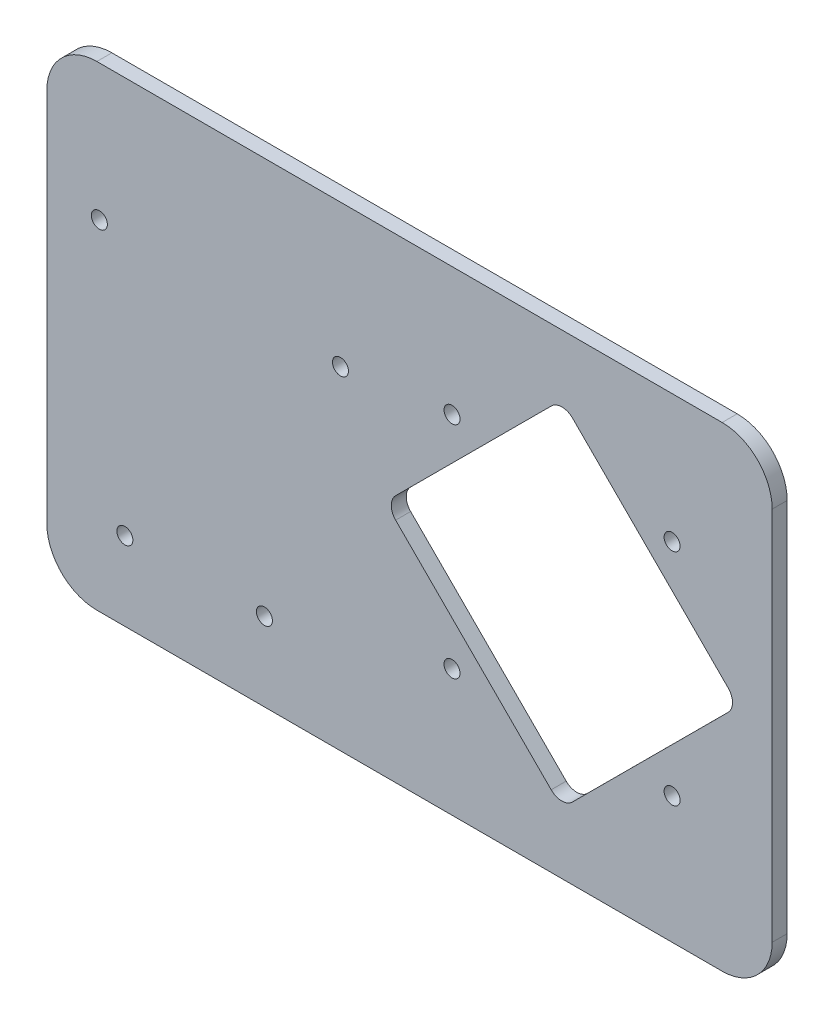
from build123d import *

# Parameters (mm, degrees)
SKETCH_1_R          = 1.600036364
EXTRUDE_1_DEPTH     = 3
CUT_EXTRUDE_1_DEPTH = 1


with BuildPart() as part:
    # 草图1 → 凸台-拉伸1 (new body)
    with BuildSketch(Plane(origin=(0, 0, 0), x_dir=(-1, 0, 0), z_dir=(0, 0, -1))):
        with BuildLine():
            Line((-269.074115321, 2.313772586), (-144.071274347, 2.313772586))
            ThreePointArc((-144.071274347, 2.313772586), (-137.000045826, 5.242771342), (-134.071047069, 12.313999864))
            Line((-134.071047069, 12.313999864), (-134.071047069, 87.314984431))
            ThreePointArc((-134.071047069, 87.314984431), (-137.000045826, 94.386212953), (-144.071274347, 97.315211709))
            Line((-144.071274347, 97.315211709), (-269.074115321, 97.315211709))
            ThreePointArc((-269.074115321, 97.315211709), (-276.145343842, 94.386212953), (-279.074342599, 87.314984431))
            Line((-279.074342599, 87.314984431), (-279.074342599, 12.313999864))
            ThreePointArc((-279.074342599, 12.313999864), (-276.145343842, 5.242771342), (-269.074115321, 2.313772586))
        make_face()
        with Locations(Location((-144.571285711, 70.12985919, 0), (0, 0, 180))):
            Circle(SKETCH_1_R, mode=Mode.SUBTRACT)
        with Locations(Location((-192.771381168, 68.83052966, 0), (0, 0, 180))):
            Circle(SKETCH_1_R, mode=Mode.SUBTRACT)
        with Locations(Location((-149.671401623, 18.029175084, 0), (0, 0, 180))):
            Circle(SKETCH_1_R, mode=Mode.SUBTRACT)
        with Locations(Location((-215.07288802, 71.689494637, 0), (0, 0, 180))):
            Circle(SKETCH_1_R, mode=Mode.SUBTRACT)
        with Locations(Location((-259.07288802, 71.689494637, 0), (0, 0, 180))):
            Circle(SKETCH_1_R, mode=Mode.SUBTRACT)
        with Locations(Location((-259.07288802, 27.689494637, 0), (0, 0, 180))):
            Circle(SKETCH_1_R, mode=Mode.SUBTRACT)
        with Locations(Location((-215.07288802, 27.689494637, 0), (0, 0, 180))):
            Circle(SKETCH_1_R, mode=Mode.SUBTRACT)
        with Locations(Location((-177.572035728, 18.029175084, 0), (0, 0, 180))):
            Circle(SKETCH_1_R, mode=Mode.SUBTRACT)
        with BuildLine():
            Line((-270.272386965, 51.970422951), (-239.177738445, 83.102172244))
            ThreePointArc((-239.177738445, 83.102172244), (-237.056894166, 83.982136522), (-234.935002086, 83.104701859))
            Line((-234.935002086, 83.104701859), (-203.802990784, 52.009791643))
            ThreePointArc((-203.802990784, 52.009791643), (-202.923026506, 49.888947364), (-203.80046117, 47.767055284))
            Line((-203.80046117, 47.767055284), (-234.89510969, 16.635305991))
            ThreePointArc((-234.89510969, 16.635305991), (-237.015953969, 15.755341713), (-239.137846048, 16.632776376))
            Line((-239.137846048, 16.632776376), (-270.26985735, 47.727686592))
            ThreePointArc((-270.26985735, 47.727686592), (-271.149821628, 49.848530871), (-270.272386965, 51.970422951))
        make_face(mode=Mode.SUBTRACT)
    extrude(amount=-EXTRUDE_1_DEPTH)

    # 草图2 → 切除-拉伸1 (cut)
    # profile 1 of 6: a face of its own
    with BuildSketch(Plane(origin=(0, 0, 0), x_dir=(-1, 0, 0), z_dir=(0, 0, -1))):
        with BuildLine():
            Line((-225.093095347, 15.50330718), (-220.537800383, 15.50330718))
            Line((-220.537800383, 15.50330718), (-220.537800383, 15.367732925))
            Line((-220.537800383, 15.367732925), (-224.222166334, 10.505497847))
            Line((-224.222166334, 10.505497847), (-222.573583394, 10.505497847))
            add(Edge.make_bspline(
                [(-222.573583394, 10.505497847), (-222.502991146, 10.507374956), (-222.3651986, 10.511038979), (-222.164076811, 10.539576628), (-221.974353471, 10.587423831), (-221.795082895, 10.653637513), (-221.626911343, 10.739532065), (-221.471208506, 10.846181354), (-221.325318206, 10.969610925), (-221.240235911, 11.065493876), (-221.197233558, 11.113955103)],
                knots=[0, 0, 0, 0, 1.087850049, 2.123429013, 3.123615998, 4.098726134, 5.063268957, 6.02621668, 7.00240907, 8, 8, 8, 8], degree=3))
            add(Edge.make_bspline(
                [(-221.197233558, 11.113955103), (-221.160213875, 11.160573702), (-221.087509946, 11.252129195), (-220.988974031, 11.393547925), (-220.900538848, 11.534279816), (-220.835970031, 11.654557391), (-220.787585924, 11.755360824), (-220.75138098, 11.83957139), (-220.713161008, 11.932034564), (-220.674217845, 12.032968505), (-220.6343878, 12.142272753), (-220.59275433, 12.259999862), (-220.550915741, 12.38634293), (-220.522905813, 12.473651547), (-220.508516343, 12.518504384)],
                knots=[0, 0, 0, 0, 1.359568562, 2.670092451, 3.935066789, 5.154440148, 5.78610453, 6.488817126, 7.247983232, 8.071572823, 8.959904472, 9.905437431, 10.923965642, 12, 12, 12, 12], degree=3))
            Line((-220.508516343, 12.518504384), (-220.372942089, 12.518504384))
            Line((-220.372942089, 12.518504384), (-220.372942089, 10.36666981))
            Line((-220.372942089, 10.36666981), (-225.44016544, 10.36666981))
            Line((-225.44016544, 10.36666981), (-225.44016544, 10.509836223))
            Line((-225.44016544, 10.509836223), (-221.760137865, 15.364479143))
            Line((-221.760137865, 15.364479143), (-222.85449325, 15.364479143))
            add(Edge.make_bspline(
                [(-222.85449325, 15.364479143), (-222.932321092, 15.363107428), (-223.084181934, 15.360430883), (-223.304433697, 15.331142607), (-223.510713089, 15.286612655), (-223.70240001, 15.222121744), (-223.879862369, 15.139424347), (-224.044182414, 15.039533689), (-224.1931042, 14.919515995), (-224.279628039, 14.8265302), (-224.323033579, 14.779882956)],
                knots=[0, 0, 0, 0, 1.143717852, 2.231668664, 3.260889947, 4.242627479, 5.198684023, 6.134108069, 7.063956852, 8, 8, 8, 8], degree=3))
            add(Edge.make_bspline(
                [(-224.323033579, 14.779882956), (-224.35709593, 14.74193829), (-224.423678301, 14.667767078), (-224.514136336, 14.552378141), (-224.593002998, 14.436514816), (-224.664774822, 14.316653148), (-224.731663607, 14.181662021), (-224.801488526, 14.023253525), (-224.877511199, 13.836281404), (-224.927552826, 13.70122689), (-224.95426731, 13.62912868)],
                knots=[0, 0, 0, 0, 0.924735901, 1.807600145, 2.6570251, 3.465651904, 4.339606012, 5.387636385, 6.60540209, 8, 8, 8, 8], degree=3))
            Line((-224.95426731, 13.62912868), (-225.093095347, 13.62912868))
            Line((-225.093095347, 13.62912868), (-225.093095347, 15.50330718))
        make_face()
    # profile 2 of 6: a face of its own
    with BuildSketch(Plane(origin=(0, 0, 0), x_dir=(-1, 0, 0), z_dir=(0, 0, -1))):
        with BuildLine():
            Line((-217.449744234, 15.50330718), (-213.954097646, 15.50330718))
            Line((-213.954097646, 15.50330718), (-213.954097646, 15.364479143))
            Line((-213.954097646, 15.364479143), (-214.104856217, 15.364479143))
            add(Edge.make_bspline(
                [(-214.104856217, 15.364479143), (-214.142870964, 15.364181767), (-214.21621477, 15.363608026), (-214.322472747, 15.349928298), (-214.422101794, 15.334624697), (-214.513801362, 15.307205802), (-214.599144004, 15.276152154), (-214.675543907, 15.233244773), (-214.746246321, 15.18657651), (-214.809248497, 15.131067788), (-214.864572903, 15.068543259), (-214.911204911, 14.997401002), (-214.953340595, 14.920807002), (-214.984733938, 14.835277091), (-215.011916171, 14.743876312), (-215.027611629, 14.644316982), (-215.04099329, 14.538013313), (-215.041621466, 14.464316591), (-215.041945467, 14.426305299)],
                knots=[0, 0, 0, 0, 1.198099385, 2.311554734, 3.376640542, 4.373067655, 5.326255445, 6.234719907, 7.129985635, 7.994799234, 8.875709313, 9.755141355, 10.673645976, 11.626833767, 12.62326088, 13.677111356, 14.801900615, 16, 16, 16, 16], degree=3))
            Line((-215.041945467, 14.426305299), (-215.041945467, 11.92414685))
            add(Edge.make_bspline(
                [(-215.041945467, 11.92414685), (-215.043044621, 11.865518579), (-215.045182394, 11.751490954), (-215.066144488, 11.585117307), (-215.101255019, 11.428952375), (-215.146828417, 11.280932446), (-215.209932476, 11.143770784), (-215.284229396, 11.014984669), (-215.374074392, 10.896668052), (-215.443187673, 10.826194769), (-215.477952271, 10.790746079)],
                knots=[0, 0, 0, 0, 1.125456421, 2.188928965, 3.213036232, 4.196668943, 5.156769506, 6.105761512, 7.047181143, 8, 8, 8, 8], degree=3))
            add(Edge.make_bspline(
                [(-215.477952271, 10.790746079), (-215.525742034, 10.746487227), (-215.622002872, 10.65733855), (-215.786828244, 10.544919961), (-215.966509502, 10.448166049), (-216.160719601, 10.368256914), (-216.366462214, 10.305997125), (-216.580805588, 10.260292592), (-216.802949915, 10.232439092), (-216.953642712, 10.229387944), (-217.030006341, 10.227841773)],
                knots=[0, 0, 0, 0, 0.92263251, 1.858418469, 2.819561564, 3.812595635, 4.831071282, 5.86375816, 6.917458677, 8, 8, 8, 8], degree=3))
            add(Edge.make_bspline(
                [(-217.030006341, 10.227841773), (-217.100963233, 10.228969701), (-217.239726399, 10.231175476), (-217.442205532, 10.258093806), (-217.634897837, 10.295094741), (-217.815177665, 10.352786265), (-217.983507893, 10.421793316), (-218.136708102, 10.507972439), (-218.276813777, 10.605272282), (-218.35775231, 10.682992532), (-218.397679424, 10.721332061)],
                knots=[0, 0, 0, 0, 1.139922734, 2.229230785, 3.279057952, 4.290118138, 5.267021879, 6.198502615, 7.111318327, 8, 8, 8, 8], degree=3))
            add(Edge.make_bspline(
                [(-218.397679424, 10.721332061), (-218.421191226, 10.748137173), (-218.467882332, 10.801368327), (-218.530814935, 10.88607841), (-218.58626474, 10.974192423), (-218.634103603, 11.06457618), (-218.671731208, 11.156622132), (-218.700611722, 11.24742317), (-218.717591139, 11.337469176), (-218.719799217, 11.39696785), (-218.720888448, 11.426318186)],
                knots=[0, 0, 0, 0, 1.079443308, 2.143621388, 3.191568851, 4.22974851, 5.236153361, 6.198851848, 7.111504505, 8, 8, 8, 8], degree=3))
            add(Edge.make_bspline(
                [(-218.720888448, 11.426318186), (-218.718271666, 11.472103778), (-218.713116035, 11.562311384), (-218.675521829, 11.692823353), (-218.610546188, 11.81182937), (-218.524170802, 11.918358413), (-218.420470188, 12.00827011), (-218.302257925, 12.073494113), (-218.173143064, 12.113252495), (-218.083429598, 12.118021728), (-218.037594203, 12.120458371)],
                knots=[0, 0, 0, 0, 1.015781138, 2.001310481, 2.985139167, 4.006642527, 5.031199339, 6.011814926, 6.984218862, 8, 8, 8, 8], degree=3))
            add(Edge.make_bspline(
                [(-218.037594203, 12.120458371), (-217.99249367, 12.1187642), (-217.905164191, 12.115483726), (-217.781441137, 12.078947914), (-217.670239407, 12.022380583), (-217.575964433, 11.941919803), (-217.498193787, 11.845412045), (-217.442490712, 11.733670549), (-217.407371183, 11.60990578), (-217.403840463, 11.523089981), (-217.402022096, 11.4783787)],
                knots=[0, 0, 0, 0, 1.065798538, 2.063736807, 3.029378486, 4.002365281, 4.977763073, 5.947122128, 6.942740848, 8, 8, 8, 8], degree=3))
            add(Edge.make_bspline(
                [(-217.402022096, 11.4783787), (-217.403389839, 11.442462718), (-217.406044628, 11.372749774), (-217.429339199, 11.272037191), (-217.468624533, 11.180438245), (-217.523089818, 11.09694631), (-217.593193583, 11.022735183), (-217.679969276, 10.958398634), (-217.780985823, 10.901866543), (-217.855689081, 10.872973772), (-217.89442779, 10.85799091)],
                knots=[0, 0, 0, 0, 1.009998177, 1.960407123, 2.890438749, 3.802138954, 4.752438927, 5.747718204, 6.832039016, 8, 8, 8, 8], degree=3))
            add(Edge.make_bspline(
                [(-217.89442779, 10.85799091), (-217.916853508, 10.849997857), (-217.956295462, 10.835939819), (-218.003759724, 10.809030063), (-218.037304429, 10.781090001), (-218.042792057, 10.75760782), (-218.045186362, 10.747362318)],
                knots=[0, 0, 0, 0, 1.452496952, 2.554625878, 3.369369368, 4, 4, 4, 4], degree=3))
            add(Edge.make_bspline(
                [(-218.045186362, 10.747362318), (-218.042046119, 10.730217855), (-218.034836085, 10.690853971), (-217.989670707, 10.636924148), (-217.924867527, 10.579156619), (-217.869826527, 10.544409519), (-217.839113494, 10.52502054)],
                knots=[0, 0, 0, 0, 0.658930445, 1.512911934, 2.612197884, 4, 4, 4, 4], degree=3))
            add(Edge.make_bspline(
                [(-217.839113494, 10.52502054), (-217.795775324, 10.500148093), (-217.705878114, 10.448554693), (-217.5500105, 10.402951866), (-217.377324928, 10.370994082), (-217.255418605, 10.368155546), (-217.191610853, 10.36666981)],
                knots=[0, 0, 0, 0, 0.885303395, 1.83640205, 2.867537638, 4, 4, 4, 4], degree=3))
            add(Edge.make_bspline(
                [(-217.191610853, 10.36666981), (-217.13873438, 10.367990495), (-217.03679147, 10.370536704), (-216.889748152, 10.393909263), (-216.754649321, 10.431169091), (-216.63144783, 10.484715028), (-216.52152626, 10.553578668), (-216.423794856, 10.634899629), (-216.341316876, 10.731327468), (-216.272697955, 10.840594265), (-216.218402618, 10.962942488), (-216.179493414, 11.09714197), (-216.156524842, 11.243316873), (-216.153920761, 11.344526552), (-216.152569763, 11.397034147)],
                knots=[0, 0, 0, 0, 1.144909914, 2.207322904, 3.216545562, 4.174109599, 5.106515027, 6.01815929, 6.917880808, 7.843649578, 8.804379971, 9.808238601, 10.862913887, 12, 12, 12, 12], degree=3))
            Line((-216.152569763, 11.397034147), (-216.152569763, 14.427389893))
            add(Edge.make_bspline(
                [(-216.152569763, 14.427389893), (-216.153048642, 14.465380904), (-216.153976611, 14.538999778), (-216.165246601, 14.645540653), (-216.182325686, 14.744548886), (-216.205931572, 14.836610624), (-216.237492214, 14.921146466), (-216.275207681, 14.999065923), (-216.321154689, 15.068740439), (-216.373796019, 15.131502502), (-216.433564407, 15.186872655), (-216.500255531, 15.234865088), (-216.573704577, 15.275548233), (-216.654516316, 15.307487326), (-216.74181495, 15.334016939), (-216.836342108, 15.351912654), (-216.937547338, 15.363004858), (-217.007199227, 15.363978431), (-217.043021469, 15.364479143)],
                knots=[0, 0, 0, 0, 1.228947725, 2.381451388, 3.462436122, 4.478339941, 5.451931521, 6.378040544, 7.273643933, 8.14547182, 9.023011543, 9.902965623, 10.798416166, 11.732618772, 12.709788841, 13.746894329, 14.841218845, 16, 16, 16, 16], degree=3))
            Line((-217.043021469, 15.364479143), (-217.449744234, 15.364479143))
            Line((-217.449744234, 15.364479143), (-217.449744234, 15.50330718))
        make_face()
    # profile 3 of 6: a face of its own
    with BuildSketch(Plane(origin=(0, 0, 0), x_dir=(-1, 0, 0), z_dir=(0, 0, -1))):
        with BuildLine():
            Line((-212.722866492, 15.50330718), (-209.154552103, 15.50330718))
            Line((-209.154552103, 15.50330718), (-209.154552103, 15.364479143))
            Line((-209.154552103, 15.364479143), (-209.555851898, 15.364479143))
            add(Edge.make_bspline(
                [(-209.555851898, 15.364479143), (-209.593114914, 15.363959795), (-209.665641321, 15.36294897), (-209.77087073, 15.352118997), (-209.868730245, 15.33359613), (-209.959382846, 15.309063259), (-210.042480775, 15.276602076), (-210.117732054, 15.235846526), (-210.186798091, 15.189457392), (-210.248095602, 15.134718871), (-210.301544303, 15.072018319), (-210.348525594, 15.002356882), (-210.387665189, 14.924688441), (-210.418859787, 14.839355738), (-210.44367786, 14.746776336), (-210.462205152, 14.646374498), (-210.472958539, 14.538255883), (-210.473979082, 14.463567326), (-210.474503049, 14.425220705)],
                knots=[0, 0, 0, 0, 1.183666125, 2.3038138, 3.355928178, 4.345281173, 5.283849776, 6.183219152, 7.059401939, 7.921771364, 8.785211201, 9.670905375, 10.585333788, 11.541245421, 12.552756763, 13.62745447, 14.781886972, 16, 16, 16, 16], degree=3))
            Line((-210.474503049, 14.425220705), (-210.474503049, 11.804841506))
            add(Edge.make_bspline(
                [(-210.474503049, 11.804841506), (-210.472072793, 11.732723288), (-210.467347346, 11.592494917), (-210.428761209, 11.390168498), (-210.365570566, 11.203463278), (-210.277848064, 11.032486849), (-210.162987175, 10.880868142), (-210.027831021, 10.745865644), (-209.86871379, 10.631293845), (-209.689195642, 10.534535196), (-209.488806453, 10.459149786), (-209.270045013, 10.405267685), (-209.033711836, 10.372399683), (-208.870136641, 10.368619195), (-208.78579013, 10.36666981)],
                knots=[0, 0, 0, 0, 1.034620493, 2.01174059, 2.943918765, 3.856135388, 4.757062871, 5.663474232, 6.588357472, 7.561278922, 8.582945766, 9.652823849, 10.789693508, 12, 12, 12, 12], degree=3))
            add(Edge.make_bspline(
                [(-208.78579013, 10.36666981), (-208.710529543, 10.368417902), (-208.561761441, 10.371873366), (-208.342877058, 10.396812581), (-208.131928557, 10.439727091), (-207.930641442, 10.497229558), (-207.742712551, 10.570255659), (-207.572760864, 10.656481082), (-207.422832918, 10.75626479), (-207.337310732, 10.834822529), (-207.29555792, 10.873175226)],
                knots=[0, 0, 0, 0, 1.120644207, 2.215184851, 3.275247005, 4.323140333, 5.328904462, 6.272763422, 7.156745323, 8, 8, 8, 8], degree=3))
            add(Edge.make_bspline(
                [(-207.29555792, 10.873175226), (-207.260978804, 10.911817024), (-207.191459486, 10.98950413), (-207.104042654, 11.120760064), (-207.029769269, 11.263006724), (-206.969225503, 11.41607312), (-206.922349852, 11.580694652), (-206.889504165, 11.756427971), (-206.868144575, 11.943506617), (-206.866048724, 12.071952099), (-206.864974086, 12.137811876)],
                knots=[0, 0, 0, 0, 0.907850671, 1.825181402, 2.754749982, 3.716017578, 4.704708414, 5.749775835, 6.846208846, 8, 8, 8, 8], degree=3))
            Line((-206.864974086, 12.137811876), (-206.864974086, 13.985960119))
            add(Edge.make_bspline(
                [(-206.864974086, 13.985960119), (-206.866230792, 14.0568918), (-206.868649462, 14.193407754), (-206.892608403, 14.389578647), (-206.932169377, 14.568151588), (-206.987212314, 14.728949954), (-207.058005815, 14.872716287), (-207.146407747, 14.997866681), (-207.249825287, 15.106877388), (-207.330996341, 15.162969018), (-207.371479503, 15.190944096)],
                knots=[0, 0, 0, 0, 1.245753361, 2.39759167, 3.465474722, 4.453792469, 5.376996215, 6.270462566, 7.137412406, 8, 8, 8, 8], degree=3))
            add(Edge.make_bspline(
                [(-207.371479503, 15.190944096), (-207.419783118, 15.218788335), (-207.515634796, 15.274041281), (-207.650314106, 15.316990431), (-207.76871935, 15.338123953), (-207.874864122, 15.350550651), (-207.998575563, 15.360492548), (-208.086928109, 15.363094429), (-208.133949112, 15.364479143)],
                knots=[0, 0, 0, 0, 1.263201928, 2.506645158, 3.182866477, 3.993341604, 4.932061436, 6, 6, 6, 6], degree=3))
            Line((-208.133949112, 15.364479143), (-208.133949112, 15.50330718))
            Line((-208.133949112, 15.50330718), (-205.653482545, 15.50330718))
            Line((-205.653482545, 15.50330718), (-205.653482545, 15.364479143))
            add(Edge.make_bspline(
                [(-205.653482545, 15.364479143), (-205.690034849, 15.361205261), (-205.75933642, 15.354998123), (-205.857091036, 15.340966667), (-205.943035048, 15.323990182), (-206.043606365, 15.296336193), (-206.164564755, 15.24449961), (-206.251683044, 15.185338732), (-206.297731404, 15.154067899)],
                knots=[0, 0, 0, 0, 0.959871685, 1.819874719, 2.582181741, 3.249919705, 4.546382294, 6, 6, 6, 6], degree=3))
            add(Edge.make_bspline(
                [(-206.297731404, 15.154067899), (-206.331072424, 15.125991543), (-206.397779748, 15.06981754), (-206.484271297, 14.969269011), (-206.558007672, 14.855576116), (-206.620194003, 14.729452046), (-206.667482285, 14.590392347), (-206.702157418, 14.440015528), (-206.722942368, 14.277574531), (-206.725055669, 14.165342164), (-206.726146049, 14.107434651)],
                knots=[0, 0, 0, 0, 0.891296972, 1.783269844, 2.703003498, 3.659672428, 4.65452199, 5.703075205, 6.814876632, 8, 8, 8, 8], degree=3))
            Line((-206.726146049, 14.107434651), (-206.726146049, 12.048875165))
            add(Edge.make_bspline(
                [(-206.726146049, 12.048875165), (-206.72771804, 11.982305708), (-206.73076737, 11.85317502), (-206.751059969, 11.665061345), (-206.786983119, 11.48952901), (-206.83544311, 11.324945258), (-206.899327719, 11.172771761), (-206.97815767, 11.032889978), (-207.070185921, 10.904306051), (-207.143087746, 10.829300311), (-207.179506358, 10.791830673)],
                knots=[0, 0, 0, 0, 1.162756437, 2.255501963, 3.299502036, 4.288422551, 5.247788254, 6.175176988, 7.088397021, 8, 8, 8, 8], degree=3))
            add(Edge.make_bspline(
                [(-207.179506358, 10.791830673), (-207.219593448, 10.754395424), (-207.298301015, 10.680894518), (-207.42715032, 10.588407016), (-207.558605901, 10.509306313), (-207.651143325, 10.470459065), (-207.696857714, 10.451268145)],
                knots=[0, 0, 0, 0, 1.054621979, 2.070659909, 3.046887177, 4, 4, 4, 4], degree=3))
            add(Edge.make_bspline(
                [(-207.696857714, 10.451268145), (-207.746199221, 10.433342648), (-207.846525499, 10.396894663), (-208.003178445, 10.352103593), (-208.166165148, 10.31247153), (-208.336675444, 10.283168095), (-208.51338957, 10.257344933), (-208.697698654, 10.240907892), (-208.888676901, 10.229301139), (-209.018236024, 10.228333397), (-209.084053491, 10.227841773)],
                knots=[0, 0, 0, 0, 0.891566565, 1.812825789, 2.766219052, 3.739639371, 4.75065812, 5.799366071, 6.88205363, 8, 8, 8, 8], degree=3))
            add(Edge.make_bspline(
                [(-209.084053491, 10.227841773), (-209.180983286, 10.229332895), (-209.370392751, 10.23224668), (-209.647496076, 10.253983992), (-209.910882241, 10.290626403), (-210.159251251, 10.341911012), (-210.390112181, 10.407856378), (-210.601540367, 10.485567444), (-210.792989409, 10.575624042), (-210.907932453, 10.648922143), (-210.963654961, 10.684455863)],
                knots=[0, 0, 0, 0, 1.185940103, 2.317432746, 3.398467779, 4.43782573, 5.41793926, 6.333323014, 7.192022255, 8, 8, 8, 8], degree=3))
            add(Edge.make_bspline(
                [(-210.963654961, 10.684455863), (-211.013007174, 10.719826315), (-211.109995621, 10.789337387), (-211.237717547, 10.911578415), (-211.344576379, 11.046490066), (-211.433773407, 11.191244006), (-211.500895081, 11.348357293), (-211.550105934, 11.515698847), (-211.579894608, 11.69496202), (-211.583352636, 11.818464484), (-211.585127345, 11.881847683)],
                knots=[0, 0, 0, 0, 1.032984291, 2.030051666, 2.998193363, 3.956835243, 4.916326676, 5.898092387, 6.921271509, 8, 8, 8, 8], degree=3))
            Line((-211.585127345, 11.881847683), (-211.585127345, 14.425220705))
            add(Edge.make_bspline(
                [(-211.585127345, 14.425220705), (-211.585628092, 14.463209261), (-211.586598437, 14.536823376), (-211.597578484, 14.643461797), (-211.61579816, 14.742948036), (-211.641918714, 14.835047947), (-211.674061275, 14.920451723), (-211.714499187, 14.997762592), (-211.761597119, 15.068091413), (-211.815538064, 15.131510553), (-211.878669808, 15.186043126), (-211.948034056, 15.233927046), (-212.02504552, 15.274200426), (-212.108861733, 15.307910283), (-212.200041589, 15.334140262), (-212.298750302, 15.350225376), (-212.404004804, 15.363508015), (-212.476976687, 15.364148634), (-212.514624437, 15.364479143)],
                knots=[0, 0, 0, 0, 1.202317824, 2.329848042, 3.389451109, 4.400397054, 5.356940965, 6.273334065, 7.155862536, 8.03235821, 8.900216767, 9.78917931, 10.695437472, 11.645522352, 12.645457828, 13.691747676, 14.809123437, 16, 16, 16, 16], degree=3))
            Line((-212.514624437, 15.364479143), (-212.722866492, 15.364479143))
            Line((-212.722866492, 15.364479143), (-212.722866492, 15.50330718))
        make_face()
    # profile 4 of 6: a face of its own
    with BuildSketch(Plane(origin=(0, 0, 0), x_dir=(-1, 0, 0), z_dir=(0, 0, -1))):
        with BuildLine():
            Line((-199.696675162, 15.364479143), (-199.568693066, 15.364479143))
            Line((-199.568693066, 15.364479143), (-199.568693066, 13.62912868))
            Line((-199.568693066, 13.62912868), (-199.696675162, 13.62912868))
            add(Edge.make_bspline(
                [(-199.696675162, 13.62912868), (-199.715808386, 13.680257769), (-199.753111857, 13.779942619), (-199.814398013, 13.92372695), (-199.877309734, 14.058827241), (-199.940376512, 14.186368276), (-200.008569379, 14.303464473), (-200.076558517, 14.412925907), (-200.145457921, 14.51494426), (-200.195862967, 14.577039525), (-200.220534083, 14.607432503)],
                knots=[0, 0, 0, 0, 1.175104864, 2.291066666, 3.363545726, 4.383364311, 5.352569365, 6.279020888, 7.157654259, 8, 8, 8, 8], degree=3))
            add(Edge.make_bspline(
                [(-200.220534083, 14.607432503), (-200.257443383, 14.647528246), (-200.332541556, 14.729109771), (-200.459936474, 14.840302835), (-200.600980725, 14.943360511), (-200.753605768, 15.039969898), (-200.918362264, 15.127300606), (-201.093179062, 15.205734584), (-201.278282111, 15.272681406), (-201.471054833, 15.329473762), (-201.668955906, 15.376439849), (-201.869277696, 15.410013558), (-202.071158724, 15.430132035), (-202.206019281, 15.432636716), (-202.2736706, 15.433893161)],
                knots=[0, 0, 0, 0, 0.861605881, 1.753081951, 2.669309869, 3.622901531, 4.607925055, 5.616572816, 6.651453525, 7.719095936, 8.794187388, 9.866964194, 10.929985983, 12, 12, 12, 12], degree=3))
            add(Edge.make_bspline(
                [(-202.2736706, 15.433893161), (-202.322875291, 15.432796164), (-202.418994436, 15.430653229), (-202.559103443, 15.415605338), (-202.691259258, 15.389629902), (-202.814815356, 15.353078619), (-202.929336815, 15.305953043), (-203.035659004, 15.250733415), (-203.132954965, 15.184843955), (-203.190028134, 15.132381474), (-203.218352008, 15.106345761)],
                knots=[0, 0, 0, 0, 1.151586221, 2.249571708, 3.29339928, 4.300036893, 5.2601469, 6.18747997, 7.100495241, 8, 8, 8, 8], degree=3))
            add(Edge.make_bspline(
                [(-203.218352008, 15.106345761), (-203.255022671, 15.066737402), (-203.328011771, 14.987901128), (-203.395007955, 14.871625692), (-203.435852421, 14.776481575), (-203.458096952, 14.706084621), (-203.471612141, 14.636878448), (-203.473429062, 14.590857529), (-203.474316201, 14.568387118)],
                knots=[0, 0, 0, 0, 1.588777153, 3.16229386, 3.927156337, 4.642500351, 5.337180238, 6, 6, 6, 6], degree=3))
            add(Edge.make_bspline(
                [(-203.474316201, 14.568387118), (-203.471755804, 14.527598223), (-203.466708303, 14.447188029), (-203.427812108, 14.33108438), (-203.363913183, 14.223875893), (-203.3050328, 14.163454666), (-203.274750898, 14.132380314)],
                knots=[0, 0, 0, 0, 0.990804432, 1.953246749, 2.947364462, 4, 4, 4, 4], degree=3))
            add(Edge.make_bspline(
                [(-203.274750898, 14.132380314), (-203.258103691, 14.11677734), (-203.223280918, 14.084138901), (-203.160900781, 14.041108908), (-203.089841308, 13.998184335), (-203.00859351, 13.955283349), (-202.9161136, 13.914249671), (-202.811348273, 13.874860475), (-202.695397823, 13.832846587), (-202.563673145, 13.792926889), (-202.412415102, 13.749323086), (-202.235595958, 13.705480592), (-202.033046951, 13.652000694), (-201.888369033, 13.617920423), (-201.811633539, 13.599844641)],
                knots=[0, 0, 0, 0, 0.522106973, 1.092147927, 1.731407964, 2.424284969, 3.195516386, 4.047724456, 4.988264309, 6.020516799, 7.200406023, 8.594674768, 10.193854901, 12, 12, 12, 12], degree=3))
            add(Edge.make_bspline(
                [(-201.811633539, 13.599844641), (-201.791385097, 13.594065445), (-201.754517583, 13.583542928), (-201.704784918, 13.569266984), (-201.665475711, 13.558857849), (-201.642462557, 13.554893188), (-201.632675522, 13.553207097)],
                knots=[0, 0, 0, 0, 1.365477475, 2.486204181, 3.356212868, 4, 4, 4, 4], degree=3))
            Line((-201.632675522, 13.553207097), (-201.452632912, 13.509823336))
            Line((-201.452632912, 13.509823336), (-201.16738468, 13.437155535))
            add(Edge.make_bspline(
                [(-201.16738468, 13.437155535), (-201.109132691, 13.422141698), (-200.996439763, 13.393096282), (-200.833943195, 13.348251446), (-200.682972821, 13.30631907), (-200.544411148, 13.265335774), (-200.418240355, 13.225104982), (-200.304253241, 13.186259117), (-200.202719729, 13.148392932), (-200.084373706, 13.101199677), (-199.949673043, 13.038368883), (-199.801786525, 12.949554586), (-199.664423464, 12.851397553), (-199.583104721, 12.775391937), (-199.542662809, 12.73759238)],
                knots=[0, 0, 0, 0, 1.209484786, 2.339840866, 3.389257254, 4.359833054, 5.244898727, 6.051764187, 6.780883699, 7.423404301, 8.613489217, 9.764137735, 10.888047912, 12, 12, 12, 12], degree=3))
            add(Edge.make_bspline(
                [(-199.542662809, 12.73759238), (-199.513092503, 12.708544758), (-199.454497685, 12.650985661), (-199.377998122, 12.554013899), (-199.311869282, 12.450062334), (-199.256694159, 12.339047842), (-199.211723629, 12.223106362), (-199.18018747, 12.101585853), (-199.161557858, 11.975341171), (-199.158951223, 11.88950196), (-199.157631925, 11.84605608)],
                knots=[0, 0, 0, 0, 0.994566719, 1.970776275, 2.958231928, 3.948279333, 4.943073372, 5.939078914, 6.956904077, 8, 8, 8, 8], degree=3))
            add(Edge.make_bspline(
                [(-199.157631925, 11.84605608), (-199.159277353, 11.802239044), (-199.162572181, 11.714499213), (-199.183722032, 11.582726777), (-199.220044733, 11.451385201), (-199.269530453, 11.320877856), (-199.332386627, 11.194692028), (-199.406284791, 11.074247277), (-199.493264565, 10.961856516), (-199.560023311, 10.89421834), (-199.593638729, 10.860160098)],
                knots=[0, 0, 0, 0, 0.950449327, 1.90319275, 2.886711018, 3.90182826, 4.925871902, 5.939989103, 6.962710778, 8, 8, 8, 8], degree=3))
            add(Edge.make_bspline(
                [(-199.593638729, 10.860160098), (-199.640329764, 10.815213803), (-199.734276316, 10.724777826), (-199.895107655, 10.61020144), (-200.071313475, 10.512866079), (-200.262976449, 10.434281296), (-200.469156916, 10.371790179), (-200.689928304, 10.330042416), (-200.924051666, 10.301452442), (-201.084864006, 10.298678987), (-201.16738468, 10.297255791)],
                knots=[0, 0, 0, 0, 0.9045502, 1.820036154, 2.749312885, 3.711811853, 4.709011819, 5.754176183, 6.847558006, 8, 8, 8, 8], degree=3))
            add(Edge.make_bspline(
                [(-201.16738468, 10.297255791), (-201.225621468, 10.29797735), (-201.340824941, 10.299404731), (-201.510988829, 10.314122717), (-201.676427648, 10.336874617), (-201.840825301, 10.368434844), (-202.010761058, 10.414931201), (-202.194364928, 10.475322997), (-202.395680252, 10.54985252), (-202.534202538, 10.608325321), (-202.60664097, 10.638902914)],
                knots=[0, 0, 0, 0, 0.937141327, 1.853844236, 2.746727261, 3.624310237, 4.546022891, 5.580194318, 6.734594038, 8, 8, 8, 8], degree=3))
            add(Edge.make_bspline(
                [(-202.60664097, 10.638902914), (-202.652531124, 10.657037014), (-202.738324059, 10.690939225), (-202.858176649, 10.737319912), (-202.96163004, 10.771789525), (-203.073154558, 10.806266623), (-203.197636506, 10.835934329), (-203.295185549, 10.840578181), (-203.341995728, 10.842806593)],
                knots=[0, 0, 0, 0, 1.157313997, 2.163631113, 3.013629022, 3.713717744, 4.902897683, 6, 6, 6, 6], degree=3))
            add(Edge.make_bspline(
                [(-203.341995728, 10.842806593), (-203.383728773, 10.841319234), (-203.465241334, 10.838414138), (-203.582241776, 10.810551356), (-203.689360038, 10.765595865), (-203.785592377, 10.703563633), (-203.868873637, 10.624355674), (-203.93813795, 10.529947143), (-203.990981174, 10.419422702), (-204.012160708, 10.338916492), (-204.023120785, 10.297255791)],
                knots=[0, 0, 0, 0, 1.052167561, 2.055083061, 3.01626263, 3.973229431, 4.928758788, 5.901782621, 6.914205425, 8, 8, 8, 8], degree=3))
            Line((-204.023120785, 10.297255791), (-204.151102881, 10.297255791))
            Line((-204.151102881, 10.297255791), (-204.151102881, 12.657332421))
            Line((-204.151102881, 12.657332421), (-204.023120785, 12.657332421))
            add(Edge.make_bspline(
                [(-204.023120785, 12.657332421), (-204.015635279, 12.605838158), (-204.000766249, 12.503551188), (-203.963750904, 12.352987547), (-203.918297724, 12.205571417), (-203.858008118, 12.062934693), (-203.790659835, 11.922492807), (-203.709480456, 11.786509307), (-203.617314384, 11.654204616), (-203.548959885, 11.569802125), (-203.51444618, 11.527185432)],
                knots=[0, 0, 0, 0, 0.992729715, 1.971934528, 2.956281341, 3.934123375, 4.924860161, 5.927328838, 6.953462282, 8, 8, 8, 8], degree=3))
            add(Edge.make_bspline(
                [(-203.51444618, 11.527185432), (-203.469057342, 11.477483452), (-203.376317489, 11.375930855), (-203.21639465, 11.236813895), (-203.041552274, 11.099923472), (-202.849412052, 10.971232194), (-202.646401978, 10.851758796), (-202.435572927, 10.745204479), (-202.21956675, 10.653058713), (-202.000527148, 10.575200511), (-201.782139529, 10.513212175), (-201.56737253, 10.470307437), (-201.359078947, 10.441019547), (-201.22170794, 10.437707414), (-201.154369551, 10.436083829)],
                knots=[0, 0, 0, 0, 0.907489387, 1.854209885, 2.85534158, 3.902523447, 4.971720046, 6.031954649, 7.087533207, 8.138219963, 9.166761867, 10.147348753, 11.091842218, 12, 12, 12, 12], degree=3))
            add(Edge.make_bspline(
                [(-201.154369551, 10.436083829), (-201.096453966, 10.437574768), (-200.982380221, 10.440511405), (-200.815388207, 10.462685479), (-200.655688641, 10.498014712), (-200.505445266, 10.549187865), (-200.366346233, 10.611760716), (-200.242413081, 10.687529145), (-200.133439278, 10.772868182), (-200.043132162, 10.871542832), (-199.969722137, 10.978037008), (-199.918158068, 11.093499231), (-199.884799047, 11.215117108), (-199.881592784, 11.29920252), (-199.879971555, 11.341719851)],
                knots=[0, 0, 0, 0, 1.20044322, 2.364459466, 3.486423352, 4.586260588, 5.64952671, 6.641950948, 7.591321289, 8.509004389, 9.405034324, 10.260485583, 11.120423993, 12, 12, 12, 12], degree=3))
            add(Edge.make_bspline(
                [(-199.879971555, 11.341719851), (-199.882743762, 11.386863704), (-199.888272348, 11.476893663), (-199.931560251, 11.607814226), (-200.003784883, 11.730581202), (-200.069401863, 11.801645572), (-200.103397927, 11.838463921)],
                knots=[0, 0, 0, 0, 0.967311257, 1.929099701, 2.927069477, 4, 4, 4, 4], degree=3))
            add(Edge.make_bspline(
                [(-200.103397927, 11.838463921), (-200.141485956, 11.871257382), (-200.22314503, 11.941565131), (-200.34640037, 12.008904739), (-200.459009473, 12.064517581), (-200.558592863, 12.105966852), (-200.670043273, 12.148469605), (-200.795170842, 12.192268443), (-200.938463975, 12.238262142), (-201.103720359, 12.288110394), (-201.292774736, 12.342160197), (-201.427266187, 12.378085707), (-201.498185861, 12.397029851)],
                knots=[0, 0, 0, 0, 0.99290735, 2.128750047, 2.765949239, 3.481366221, 4.263199952, 5.128172127, 6.106281843, 7.243274738, 8.546330957, 10, 10, 10, 10], degree=3))
            Line((-201.498185861, 12.397029851), (-201.863694053, 12.494643315))
            add(Edge.make_bspline(
                [(-201.863694053, 12.494643315), (-201.933176778, 12.512830451), (-202.06655856, 12.547743194), (-202.257317486, 12.601951003), (-202.432157426, 12.649464435), (-202.589538842, 12.697461687), (-202.731589209, 12.738252655), (-202.856100959, 12.779504567), (-202.96491913, 12.81397258), (-203.030807521, 12.838923989), (-203.061085872, 12.85039016)],
                knots=[0, 0, 0, 0, 1.379457353, 2.648060762, 3.808873198, 4.859076267, 5.808180496, 6.647040322, 7.378260919, 8, 8, 8, 8], degree=3))
            add(Edge.make_bspline(
                [(-203.061085872, 12.85039016), (-203.119513147, 12.872259633), (-203.23072454, 12.913886332), (-203.38562475, 12.98158402), (-203.522122009, 13.04647802), (-203.639775766, 13.115363798), (-203.744792248, 13.187978945), (-203.838586667, 13.27040061), (-203.928050044, 13.358896787), (-203.979711238, 13.425337246), (-204.00576728, 13.458847416)],
                knots=[0, 0, 0, 0, 1.311293851, 2.495937297, 3.553102046, 4.486458966, 5.359435164, 6.232477534, 7.108525449, 8, 8, 8, 8], degree=3))
            add(Edge.make_bspline(
                [(-204.00576728, 13.458847416), (-204.04038841, 13.507349656), (-204.108545596, 13.602834008), (-204.179726587, 13.761690474), (-204.224722423, 13.927809954), (-204.229853083, 14.041347108), (-204.232447434, 14.098757899)],
                knots=[0, 0, 0, 0, 1.032278735, 2.032204388, 3.004971519, 4, 4, 4, 4], degree=3))
            add(Edge.make_bspline(
                [(-204.232447434, 14.098757899), (-204.231542305, 14.133497559), (-204.22974563, 14.20245556), (-204.217569901, 14.304379126), (-204.197876014, 14.403684823), (-204.171210683, 14.500487796), (-204.134699707, 14.594116495), (-204.091509877, 14.685278393), (-204.040117806, 14.773890182), (-203.96020043, 14.887896571), (-203.843838228, 15.022298042), (-203.677141738, 15.163270935), (-203.486450744, 15.286101719), (-203.271924675, 15.387822215), (-203.040170153, 15.471770249), (-202.792483389, 15.529002833), (-202.533300306, 15.566320217), (-202.356233435, 15.570561643), (-202.266078441, 15.572721198)],
                knots=[0, 0, 0, 0, 0.609385397, 1.209626086, 1.797954173, 2.384261862, 2.968473317, 3.558542276, 4.152484145, 4.762990646, 5.99921114, 7.258784913, 8.579955777, 9.967070861, 11.415468994, 12.895337562, 14.419236645, 16, 16, 16, 16], degree=3))
            add(Edge.make_bspline(
                [(-202.266078441, 15.572721198), (-202.196252715, 15.57113753), (-202.055554181, 15.567946445), (-201.843501732, 15.54565432), (-201.629554643, 15.508305213), (-201.413497639, 15.457553597), (-201.195891086, 15.390887162), (-200.976812825, 15.308915701), (-200.755050508, 15.213776621), (-200.609175728, 15.140379981), (-200.535066355, 15.103091979)],
                knots=[0, 0, 0, 0, 0.925321987, 1.864519746, 2.822353237, 3.802046661, 4.803879245, 5.836271587, 6.900752026, 8, 8, 8, 8], degree=3))
            add(Edge.make_bspline(
                [(-200.535066355, 15.103091979), (-200.487318337, 15.079501426), (-200.400830263, 15.036770825), (-200.280354291, 14.990189206), (-200.186083448, 14.956543261), (-200.129949125, 14.950502237), (-200.106651709, 14.947995032)],
                knots=[0, 0, 0, 0, 1.393978184, 2.524973685, 3.387820137, 4, 4, 4, 4], degree=3))
            add(Edge.make_bspline(
                [(-200.106651709, 14.947995032), (-200.083733937, 14.949207447), (-200.038477951, 14.951601617), (-199.973321511, 14.971904708), (-199.913455957, 15.005473627), (-199.858675305, 15.051854431), (-199.80958124, 15.111563246), (-199.766579206, 15.184385629), (-199.727156186, 15.269265205), (-199.70717686, 15.331674863), (-199.696675162, 15.364479143)],
                knots=[0, 0, 0, 0, 0.871985791, 1.721920331, 2.573082536, 3.47282195, 4.44135752, 5.504730185, 6.688415689, 8, 8, 8, 8], degree=3))
        make_face()
    # profile 5 of 6: a face of its own
    with BuildSketch(Plane(origin=(0, 0, 0), x_dir=(-1, 0, 0), z_dir=(0, 0, -1))):
        with BuildLine():
            Line((-194.489322261, 12.865574476), (-195.647668695, 12.865574476))
            Line((-195.647668695, 12.865574476), (-195.647668695, 11.434994939))
            add(Edge.make_bspline(
                [(-195.647668695, 11.434994939), (-195.647186265, 11.397004827), (-195.646255981, 11.323747473), (-195.635113181, 11.217485981), (-195.617107692, 11.118697354), (-195.591034513, 11.0272325), (-195.558104824, 10.943153527), (-195.52007608, 10.865214345), (-195.470977614, 10.796773089), (-195.416970397, 10.734063987), (-195.354425314, 10.679536596), (-195.284462218, 10.632519426), (-195.206561575, 10.593685257), (-195.121722871, 10.560798943), (-195.029175738, 10.53657135), (-194.929588864, 10.517735113), (-194.822527522, 10.507056612), (-194.748563118, 10.506026731), (-194.710579445, 10.505497847)],
                knots=[0, 0, 0, 0, 1.201621739, 2.317119521, 3.376109128, 4.375465689, 5.320787859, 6.231420348, 7.110465611, 7.97782172, 8.845177828, 9.727195358, 10.637827846, 11.593817963, 12.601130375, 13.660119983, 14.798378261, 16, 16, 16, 16], degree=3))
            Line((-194.710579445, 10.505497847), (-194.55873628, 10.505497847))
            Line((-194.55873628, 10.505497847), (-194.55873628, 10.36666981))
            Line((-194.55873628, 10.36666981), (-197.82661812, 10.36666981))
            Line((-197.82661812, 10.36666981), (-197.82661812, 10.505497847))
            Line((-197.82661812, 10.505497847), (-197.687790083, 10.505497847))
            add(Edge.make_bspline(
                [(-197.687790083, 10.505497847), (-197.649806733, 10.506027646), (-197.575842957, 10.507059305), (-197.468777198, 10.517725289), (-197.369205557, 10.536604701), (-197.276932752, 10.560598426), (-197.192871737, 10.593700585), (-197.116044073, 10.632526217), (-197.047149194, 10.679553112), (-196.985742764, 10.734122966), (-196.932634768, 10.796731356), (-196.885197483, 10.865862299), (-196.845191442, 10.942577455), (-196.813778561, 11.027676149), (-196.789126471, 11.119951237), (-196.770769185, 11.219643927), (-196.759730811, 11.327008866), (-196.758783889, 11.400983676), (-196.758292991, 11.439333315)],
                knots=[0, 0, 0, 0, 1.202353652, 2.341305248, 3.40093989, 4.408865861, 5.354763831, 6.255756882, 7.128833979, 7.988146677, 8.848525993, 9.721603089, 10.638023497, 11.579826501, 12.587752472, 13.65864084, 14.786204657, 16, 16, 16, 16], degree=3))
            Line((-196.758292991, 11.439333315), (-196.758292991, 14.430643675))
            add(Edge.make_bspline(
                [(-196.758292991, 14.430643675), (-196.75878247, 14.468995687), (-196.759735839, 14.543694744), (-196.770955324, 14.651675915), (-196.787840205, 14.75226977), (-196.812376262, 14.844750715), (-196.845617228, 14.929072083), (-196.884058573, 15.006201844), (-196.93011443, 15.075601968), (-196.983665839, 15.136942552), (-197.045259986, 15.190493606), (-197.114168021, 15.23720218), (-197.190145244, 15.277886001), (-197.275079037, 15.308938171), (-197.367314964, 15.333655722), (-197.467370249, 15.352090691), (-197.575109845, 15.362988039), (-197.649441807, 15.363971678), (-197.687790083, 15.364479143)],
                knots=[0, 0, 0, 0, 1.212213306, 2.361054512, 3.428529135, 4.435141395, 5.3798065, 6.289806035, 7.155352303, 8.00597424, 8.856596177, 9.728535322, 10.633639255, 11.574214732, 12.580826992, 13.650319585, 14.787786694, 16, 16, 16, 16], degree=3))
            Line((-197.687790083, 15.364479143), (-197.82661812, 15.364479143))
            Line((-197.82661812, 15.364479143), (-197.82661812, 15.50330718))
            Line((-197.82661812, 15.50330718), (-193.846157996, 15.50330718))
            add(Edge.make_bspline(
                [(-193.846157996, 15.50330718), (-193.780355091, 15.502839657), (-193.652342312, 15.501930139), (-193.465759404, 15.496373639), (-193.289607914, 15.488082978), (-193.124276737, 15.475356206), (-192.969523301, 15.457767503), (-192.825211149, 15.437204124), (-192.691095139, 15.414148564), (-192.529897885, 15.376786718), (-192.344754202, 15.320986571), (-192.144151876, 15.230449079), (-191.965026753, 15.121732527), (-191.865753895, 15.029293656), (-191.816882549, 14.983786635)],
                knots=[0, 0, 0, 0, 1.1026507, 2.145093463, 3.127710445, 4.057454617, 4.923156212, 5.737071024, 6.500013756, 7.202472385, 8.509293697, 9.732155867, 10.883555914, 12, 12, 12, 12], degree=3))
            add(Edge.make_bspline(
                [(-191.816882549, 14.983786635), (-191.792046571, 14.956817578), (-191.741906029, 14.902370629), (-191.677597119, 14.810900022), (-191.620624875, 14.712511639), (-191.572786856, 14.608043558), (-191.532099557, 14.500754909), (-191.504455649, 14.391910743), (-191.48567459, 14.283789862), (-191.483772904, 14.211632947), (-191.482827584, 14.175764076)],
                knots=[0, 0, 0, 0, 0.982726558, 1.983994524, 2.992191763, 4.029367408, 5.063590783, 6.065797937, 7.038517031, 8, 8, 8, 8], degree=3))
            add(Edge.make_bspline(
                [(-191.482827584, 14.175764076), (-191.484245904, 14.128248634), (-191.487043978, 14.034509751), (-191.516730187, 13.898107257), (-191.562301555, 13.768890245), (-191.626034047, 13.646533586), (-191.709414418, 13.532566458), (-191.810617929, 13.425535961), (-191.929246121, 13.324883203), (-192.018968878, 13.26729733), (-192.065254584, 13.237590232)],
                knots=[0, 0, 0, 0, 0.983034381, 1.939338918, 2.877490213, 3.815551803, 4.786411914, 5.793214062, 6.861574848, 8, 8, 8, 8], degree=3))
            add(Edge.make_bspline(
                [(-192.065254584, 13.237590232), (-192.10506938, 13.217021291), (-192.189884875, 13.173204292), (-192.331632736, 13.118330105), (-192.492683717, 13.065022082), (-192.732415905, 13.000028093), (-193.044891859, 12.932321786), (-193.29992901, 12.902928952), (-193.426420103, 12.888350951)],
                knots=[0, 0, 0, 0, 0.570533791, 1.215379956, 1.933391765, 2.731167072, 4.378752872, 6, 6, 6, 6], degree=3))
            add(Edge.make_bspline(
                [(-193.426420103, 12.888350951), (-193.45244291, 12.886418808), (-193.507346513, 12.882342322), (-193.594529992, 12.87851584), (-193.691028463, 12.873794647), (-193.797336224, 12.87066713), (-193.913403197, 12.868862328), (-194.039206418, 12.866332257), (-194.174427066, 12.865364583), (-194.267703564, 12.865503081), (-194.315787215, 12.865574476)],
                knots=[0, 0, 0, 0, 0.703745394, 1.484780516, 2.353474026, 3.309495962, 4.35300933, 5.484265384, 6.703149161, 8, 8, 8, 8], degree=3))
            Line((-194.315787215, 12.865574476), (-194.315787215, 12.851474754))
            add(Edge.make_bspline(
                [(-194.315787215, 12.851474754), (-194.267780517, 12.820984612), (-194.174709154, 12.761872878), (-194.038131725, 12.677922896), (-193.907961063, 12.602993456), (-193.744423134, 12.515216986), (-193.543118435, 12.420472666), (-193.339063083, 12.338283031), (-193.170629949, 12.28134234), (-193.035626699, 12.243070922), (-192.892976736, 12.204714997), (-192.794539276, 12.181975753), (-192.744210452, 12.170349697)],
                knots=[0, 0, 0, 0, 0.989780157, 1.918902832, 2.789874643, 3.60340579, 5.148610692, 6.659367881, 7.429397497, 8.241832945, 9.10108937, 10, 10, 10, 10], degree=3))
            Line((-192.744210452, 12.170349697), (-192.623820514, 11.987053305))
            add(Edge.make_bspline(
                [(-192.623820514, 11.987053305), (-192.605218511, 11.959685096), (-192.570606693, 11.908762434), (-192.524887387, 11.836457666), (-192.483520818, 11.777365275), (-192.441164332, 11.70802828), (-192.385653196, 11.625102995), (-192.341431503, 11.558297694), (-192.317964995, 11.522847056)],
                knots=[0, 0, 0, 0, 1.071377605, 1.993458873, 2.769399216, 3.405936679, 4.623444599, 6, 6, 6, 6], degree=3))
            add(Edge.make_bspline(
                [(-192.317964995, 11.522847056), (-192.285268464, 11.472459206), (-192.221839795, 11.374710784), (-192.126017455, 11.234408684), (-192.033332367, 11.104103097), (-191.94239758, 10.986186535), (-191.859003251, 10.87993112), (-191.778799766, 10.79315171), (-191.710605533, 10.719306476), (-191.663616262, 10.680430437), (-191.642262908, 10.662763983)],
                knots=[0, 0, 0, 0, 1.313652749, 2.548381848, 3.715725439, 4.810091755, 5.805397304, 6.667583828, 7.394509569, 8, 8, 8, 8], degree=3))
            add(Edge.make_bspline(
                [(-191.642262908, 10.662763983), (-191.621940717, 10.649944341), (-191.580104129, 10.623552992), (-191.510224364, 10.593296877), (-191.434983889, 10.565813118), (-191.353460375, 10.543035536), (-191.265331159, 10.525768056), (-191.171052735, 10.514481756), (-191.070463947, 10.506279979), (-191.00128635, 10.505764623), (-190.965476228, 10.505497847)],
                knots=[0, 0, 0, 0, 0.817553247, 1.68306836, 2.58708467, 3.546472698, 4.56351669, 5.643721884, 6.780261055, 8, 8, 8, 8], degree=3))
            Line((-190.965476228, 10.505497847), (-190.823394409, 10.505497847))
            Line((-190.823394409, 10.505497847), (-190.823394409, 10.36666981))
            Line((-190.823394409, 10.36666981), (-192.707334255, 10.36666981))
            Line((-192.707334255, 10.36666981), (-194.489322261, 12.865574476))
        make_face()
        with BuildLine():
            Line((-195.647668695, 13.004402513), (-194.179128366, 13.004402513))
            add(Edge.make_bspline(
                [(-194.179128366, 13.004402513), (-194.096279035, 13.005651013), (-193.937793482, 13.008039315), (-193.711651504, 13.031628217), (-193.508965283, 13.071236888), (-193.328442139, 13.12568003), (-193.170433751, 13.198880964), (-193.032978641, 13.287903054), (-192.917013796, 13.394351615), (-192.823159286, 13.518722568), (-192.749414609, 13.660367696), (-192.699682027, 13.821312555), (-192.667151311, 13.999471538), (-192.664334196, 14.124630325), (-192.662865899, 14.189863798)],
                knots=[0, 0, 0, 0, 1.350300784, 2.58304035, 3.700758403, 4.712992955, 5.649061865, 6.530153912, 7.372652008, 8.201327671, 9.058053739, 9.96203005, 10.937798454, 12, 12, 12, 12], degree=3))
            add(Edge.make_bspline(
                [(-192.662865899, 14.189863798), (-192.663604172, 14.237304563), (-192.665041712, 14.329679661), (-192.684873006, 14.463038997), (-192.711839093, 14.588207185), (-192.753282737, 14.703677714), (-192.807088165, 14.809622775), (-192.870938183, 14.907266843), (-192.94803001, 14.994307552), (-193.035576355, 15.07362609), (-193.135770409, 15.142603642), (-193.247348936, 15.202773594), (-193.370926628, 15.252296308), (-193.505959282, 15.293308563), (-193.652417754, 15.325821406), (-193.810551859, 15.347873082), (-193.980009169, 15.362527893), (-194.097027488, 15.363814797), (-194.157436485, 15.364479143)],
                knots=[0, 0, 0, 0, 1.04759633, 2.039845137, 2.974223105, 3.874064963, 4.742488356, 5.595779195, 6.445244775, 7.305318815, 8.200892624, 9.126929757, 10.101876705, 11.138257986, 12.24337251, 13.414170929, 14.66510355, 16, 16, 16, 16], degree=3))
            Line((-194.157436485, 15.364479143), (-195.647668695, 15.364479143))
            Line((-195.647668695, 15.364479143), (-195.647668695, 13.004402513))
        make_face(mode=Mode.SUBTRACT)
    # profile 6 of 6: a face of its own
    with BuildSketch(Plane(origin=(0, 0, 0), x_dir=(-1, 0, 0), z_dir=(0, 0, -1))):
        with BuildLine():
            Line((-186.758119031, 15.572721198), (-186.62362937, 15.572721198))
            Line((-186.62362937, 15.572721198), (-184.555308537, 11.104193757))
            add(Edge.make_bspline(
                [(-184.555308537, 11.104193757), (-184.538806594, 11.07067167), (-184.506827126, 11.005708503), (-184.452124879, 10.915238932), (-184.39459001, 10.833897177), (-184.335231649, 10.760643382), (-184.272098103, 10.696798335), (-184.204218245, 10.643719421), (-184.133511982, 10.598291374), (-184.057483292, 10.563384898), (-183.97588508, 10.537042156), (-183.887778126, 10.519446654), (-183.793212954, 10.506581152), (-183.727810897, 10.505866012), (-183.69414087, 10.505497847)],
                knots=[0, 0, 0, 0, 1.198973114, 2.323515578, 3.389333425, 4.395342237, 5.347281372, 6.264414564, 7.156307884, 8.039017528, 8.941867626, 9.902398825, 10.920121286, 12, 12, 12, 12], degree=3))
            Line((-183.69414087, 10.505497847), (-183.559651209, 10.505497847))
            Line((-183.559651209, 10.505497847), (-183.559651209, 10.36666981))
            Line((-183.559651209, 10.36666981), (-186.539031035, 10.36666981))
            Line((-186.539031035, 10.36666981), (-186.539031035, 10.505497847))
            Line((-186.539031035, 10.505497847), (-186.151830963, 10.505497847))
            add(Edge.make_bspline(
                [(-186.151830963, 10.505497847), (-186.106970531, 10.506610635), (-186.023505715, 10.508681025), (-185.907255383, 10.521664693), (-185.810398969, 10.545963343), (-185.731282462, 10.579287768), (-185.669469949, 10.624495782), (-185.627636294, 10.683006038), (-185.600769254, 10.751328904), (-185.597984816, 10.80059773), (-185.596518815, 10.826537683)],
                knots=[0, 0, 0, 0, 1.487820893, 2.768156541, 3.870214784, 4.788044371, 5.60090005, 6.373039189, 7.143407898, 8, 8, 8, 8], degree=3))
            add(Edge.make_bspline(
                [(-185.596518815, 10.826537683), (-185.597244527, 10.844643498), (-185.598777687, 10.88289437), (-185.608777735, 10.942624182), (-185.627390762, 11.00697425), (-185.645655049, 11.065300742), (-185.665691, 11.117812594), (-185.685503527, 11.165272679), (-185.708059929, 11.220829742), (-185.734998282, 11.283468191), (-185.767293259, 11.353067109), (-185.801063088, 11.431021228), (-185.840793419, 11.515506513), (-185.867728221, 11.574518345), (-185.881767047, 11.605276203)],
                knots=[0, 0, 0, 0, 0.781480144, 1.650977654, 2.604715829, 3.670428144, 4.287626539, 5.029315537, 5.8898083, 6.875178979, 7.971402663, 9.200661874, 10.54094268, 12, 12, 12, 12], degree=3))
            add(Edge.make_bspline(
                [(-185.881767047, 11.605276203), (-185.886092701, 11.615043431), (-185.896840011, 11.639310616), (-185.915388267, 11.680109745), (-185.936504147, 11.728102944), (-185.953521051, 11.760465521), (-185.962027006, 11.776642061)],
                knots=[0, 0, 0, 0, 0.677231403, 1.682616631, 2.841648374, 4, 4, 4, 4], degree=3))
            Line((-185.962027006, 11.776642061), (-186.045540747, 11.963192236))
            Line((-186.045540747, 11.963192236), (-188.208221261, 11.963192236))
            Line((-188.208221261, 11.963192236), (-188.373079555, 11.583584322))
            add(Edge.make_bspline(
                [(-188.373079555, 11.583584322), (-188.394678019, 11.551611062), (-188.436327466, 11.489955351), (-188.480829773, 11.391103568), (-188.510368289, 11.29208811), (-188.51357558, 11.225144881), (-188.515161374, 11.192045874)],
                knots=[0, 0, 0, 0, 1.092102571, 2.105958536, 3.06352152, 4, 4, 4, 4], degree=3))
            add(Edge.make_bspline(
                [(-188.515161374, 11.192045874), (-188.513955824, 11.164084845), (-188.511512318, 11.107411167), (-188.489564439, 11.022875124), (-188.454397299, 10.93919364), (-188.406957866, 10.857339154), (-188.34833006, 10.780925332), (-188.278628935, 10.714757358), (-188.202952179, 10.655565437), (-188.145863896, 10.626450015), (-188.117115362, 10.611788063)],
                knots=[0, 0, 0, 0, 0.905807808, 1.835964594, 2.813915269, 3.843861011, 4.897180075, 5.925655707, 6.955401102, 8, 8, 8, 8], degree=3))
            add(Edge.make_bspline(
                [(-188.117115362, 10.611788063), (-188.086061174, 10.594773977), (-188.029030607, 10.563527853), (-187.954114017, 10.534445493), (-187.892796135, 10.52304883), (-187.840655824, 10.515870499), (-187.779944928, 10.50888608), (-187.736805098, 10.506681389), (-187.713646379, 10.505497847)],
                knots=[0, 0, 0, 0, 1.508366501, 2.770093352, 3.398272741, 4.160509807, 5.012508025, 6, 6, 6, 6], degree=3))
            Line((-187.713646379, 10.505497847), (-187.713646379, 10.36666981))
            Line((-187.713646379, 10.36666981), (-189.858973389, 10.36666981))
            Line((-189.858973389, 10.36666981), (-189.858973389, 10.505497847))
            add(Edge.make_bspline(
                [(-189.858973389, 10.505497847), (-189.823132087, 10.510218615), (-189.754810451, 10.519217466), (-189.658738884, 10.537236296), (-189.574341023, 10.55903875), (-189.498327503, 10.584211901), (-189.426968693, 10.618516242), (-189.354098656, 10.660304287), (-189.276775571, 10.709891893), (-189.226012875, 10.748776132), (-189.199540213, 10.769054199)],
                knots=[0, 0, 0, 0, 1.201932049, 2.291154661, 3.247495314, 4.099045794, 4.948727533, 5.87466625, 6.891641955, 8, 8, 8, 8], degree=3))
            add(Edge.make_bspline(
                [(-189.199540213, 10.769054199), (-189.166834811, 10.79631365), (-189.098556626, 10.853222471), (-189.002597212, 10.954049176), (-188.907102187, 11.070534369), (-188.812664178, 11.203836908), (-188.718802731, 11.353720891), (-188.624509609, 11.51970188), (-188.531159096, 11.7020981), (-188.472699669, 11.830622962), (-188.442493574, 11.897031999)],
                knots=[0, 0, 0, 0, 0.745011926, 1.55534126, 2.432361811, 3.380945224, 4.413671566, 5.527876368, 6.722649082, 8, 8, 8, 8], degree=3))
            Line((-188.442493574, 11.897031999), (-186.758119031, 15.572721198))
        make_face()
        Polygon((-187.145319103, 14.392682884), (-188.146399401, 12.102020273), (-186.120377736, 12.102020273), align=None, mode=Mode.SUBTRACT)
    extrude(amount=-CUT_EXTRUDE_1_DEPTH, mode=Mode.SUBTRACT)


solid = part.part
